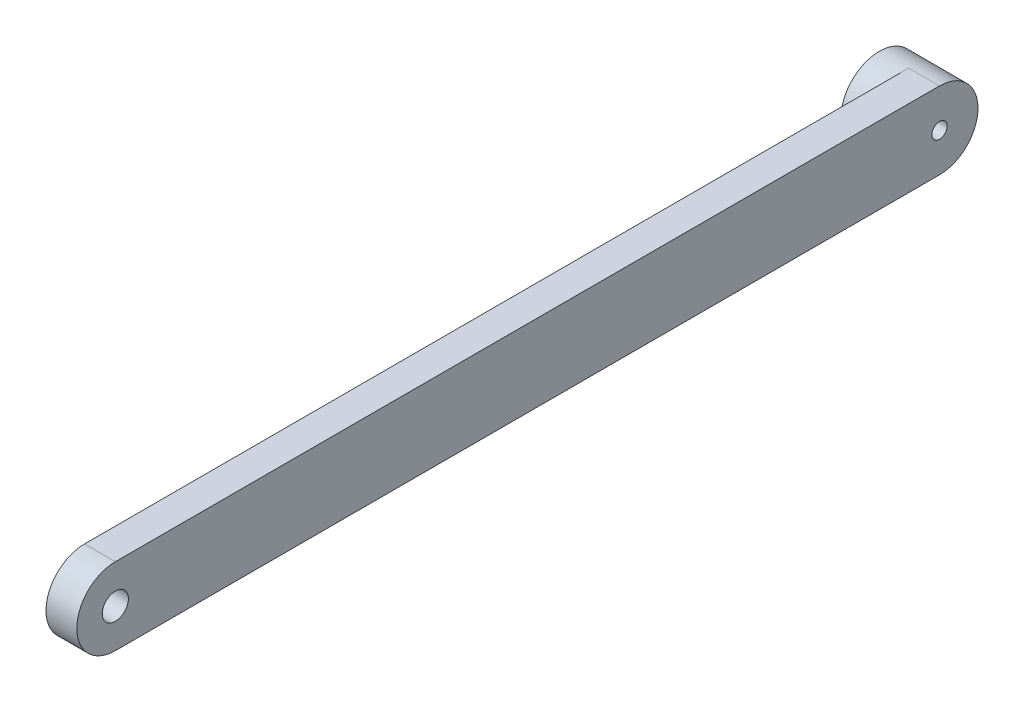
from build123d import *

# Parameters (mm, degrees)
RESSALTO_EXTRUS_O1_DEPTH = 2
CORTE_EXTRUS_O1_REACH    = 58.091
ESBO_O2_R                = 0.85
RESSALTO_EXTRUS_O2_START = 1.9
ESBO_O4_R                = 2.5
RESSALTO_EXTRUS_O2_DEPTH = 1.9
CORTE_EXTRUS_O2_REACH    = 58.191
ESBO_O3_R                = 0.5


with BuildPart() as part:
    # Esboço1 → Ressalto-extrusão1 (new body)
    with BuildSketch(Plane(origin=(0, 0, 0), x_dir=(0, 0, -1), z_dir=(1, 0, 0))):
        with BuildLine():
            Line((0, 2.5), (53.5, 2.5))
            ThreePointArc((53.5, 2.5), (56, 0), (53.5, -2.5))
            Line((53.5, -2.5), (0, -2.5))
            ThreePointArc((0, -2.5), (-2.5, 0), (0, 2.5))
        make_face()
    extrude(amount=RESSALTO_EXTRUS_O1_DEPTH)

    # Esboço2 → Corte-extrusão1 (cut, up to next)
    with BuildSketch(Plane(origin=(2, 0, 0), x_dir=(0, 0, -1), z_dir=(1, 0, 0)), mode=Mode.PRIVATE) as corte_extrus_o1_sk1:
        Circle(ESBO_O2_R)
    corte_extrus_o1_tool1 = extrude(corte_extrus_o1_sk1.sketch, amount=-CORTE_EXTRUS_O1_REACH, mode=Mode.PRIVATE) & part.part
    add(corte_extrus_o1_tool1.solids().sort_by_distance((2, 0, 0))[0], mode=Mode.SUBTRACT)

    # Esboço4 → Ressalto-extrusão2 (add)
    with BuildSketch(Plane.ZY.offset(RESSALTO_EXTRUS_O2_START)):
        with Locations((-53.5, 0)):
            Circle(ESBO_O4_R)
    extrude(amount=-RESSALTO_EXTRUS_O2_DEPTH)

    # Esboço3 → Corte-extrusão2 (cut, up to next)
    with BuildSketch(Plane(origin=(2, 0, 0), x_dir=(0, 0, -1), z_dir=(1, 0, 0)), mode=Mode.PRIVATE) as corte_extrus_o2_sk1:
        with Locations((53.5, 0)):
            Circle(ESBO_O3_R)
    corte_extrus_o2_tool1 = extrude(corte_extrus_o2_sk1.sketch, amount=-CORTE_EXTRUS_O2_REACH, mode=Mode.PRIVATE) & part.part
    add(corte_extrus_o2_tool1.solids().sort_by_distance((2, 0, -53.5))[0], mode=Mode.SUBTRACT)


solid = part.part
